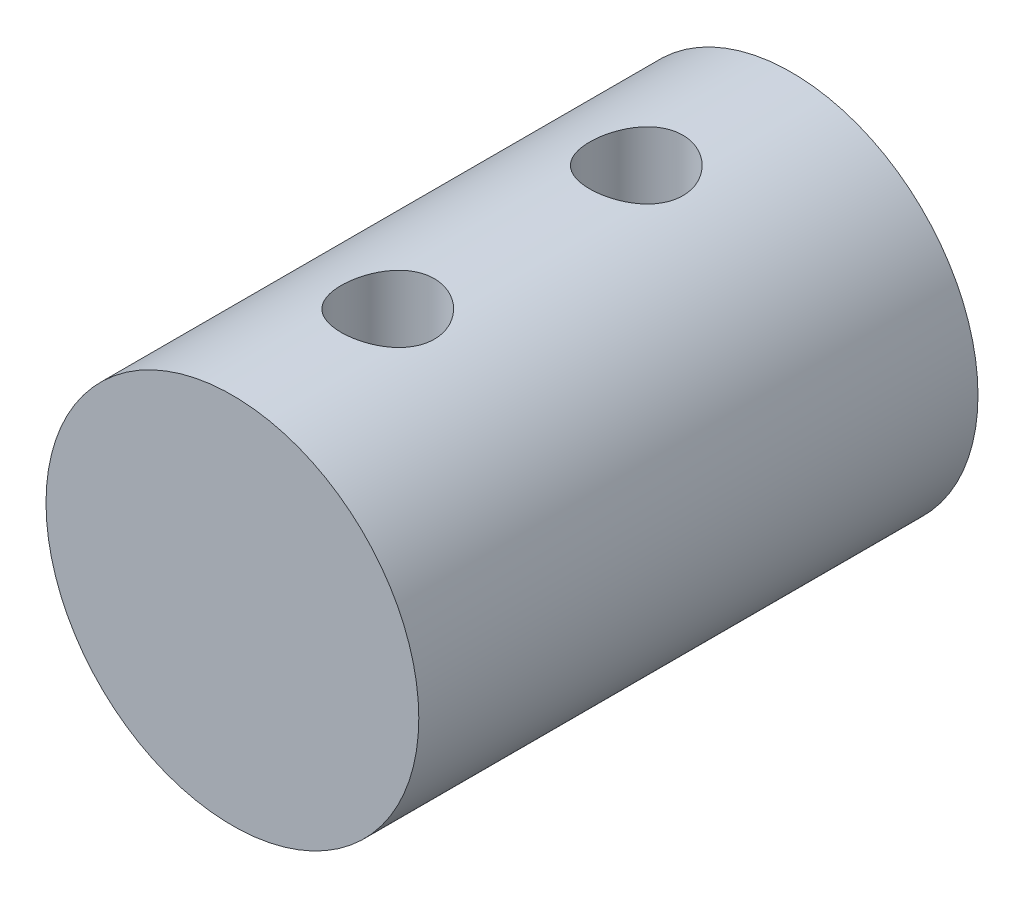
from build123d import *

# Parameters (mm, degrees)
SKETCH_1_R               = 6
EXTRUDE_1_DEPTH          = 18
CUT_EXTRUDE_1_DEPTH      = 20.899748742
CUT_EXTRUDE_1_DEPTH_BACK = 20.899748742
SKETCH_2_R               = 1.5


with BuildPart() as part:
    # 草图1 → 凸台-拉伸1 (new body)
    with BuildSketch(Plane.XY):
        Circle(SKETCH_1_R)
    extrude(amount=EXTRUDE_1_DEPTH)

    # 草图2 → 切除-拉伸1 (cut, two sides: drawn at the far end of the back side and taken through both)
    with BuildSketch(Plane(origin=(0, 0, 0), x_dir=(1, 0, 0), z_dir=(0, 1, 0)).offset(-CUT_EXTRUDE_1_DEPTH_BACK)):
        with Locations(Location((0, -5, 0), (0, 0, 270))):
            Circle(SKETCH_2_R)
        with Locations(Location((0, -13, 0), (0, 0, 270))):
            Circle(SKETCH_2_R)
    extrude(amount=CUT_EXTRUDE_1_DEPTH + CUT_EXTRUDE_1_DEPTH_BACK, mode=Mode.SUBTRACT)


solid = part.part
